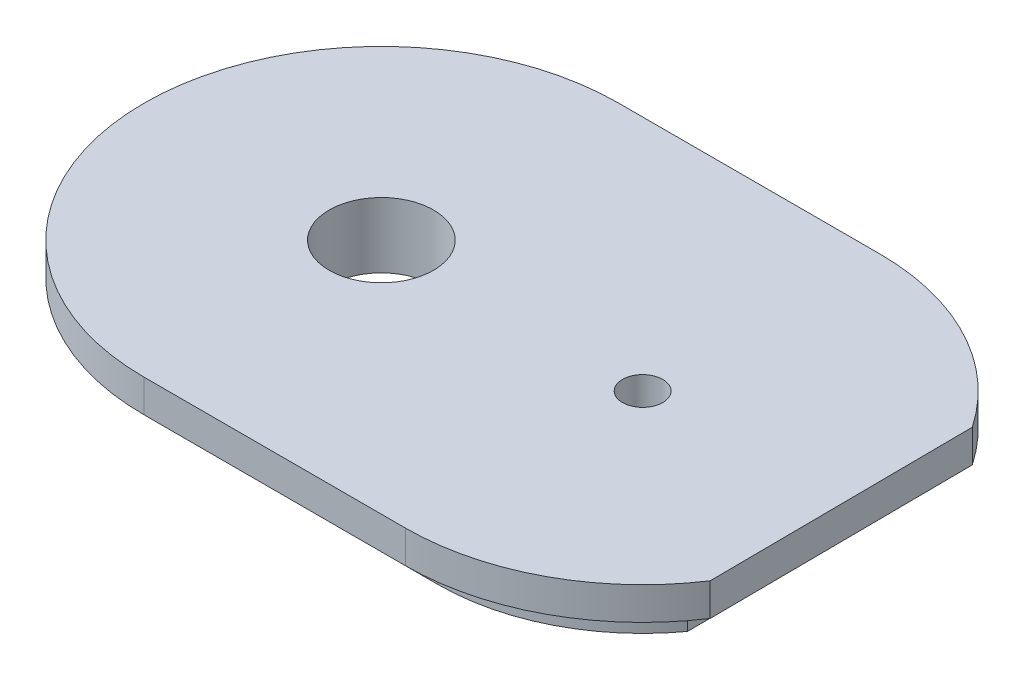
from build123d import *

# Parameters (mm, degrees)
SKETCH1_R           = 0.77
SKETCH1_R_2         = 2
BOSS_EXTRUDE2_DEPTH = 1.25
BOSS_EXTRUDE3_START = 1.25
SKETCH1_5_R         = 0.77
SKETCH1_5_R_2       = 2
BOSS_EXTRUDE3_DEPTH = 1.25


with BuildPart() as part:
    # Sketch1 → Boss-Extrude2 (new body)
    with BuildSketch(Plane(origin=(0, 0, 0), x_dir=(1, 0, 0), z_dir=(0, 1, 0))):
        with BuildLine():
            Line((-14.242139595, -7.835793251), (-4.23908362, -7.835793251))
            ThreePointArc((-4.23908362, -7.835793251), (-0.686146993, -6.984002949), (2.094345322, -4.613819859))
            Line((2.094345322, -4.613819859), (2.026352853, 4.705737102))
            ThreePointArc((2.026352853, 4.705737102), (-0.737193213, 7.009737473), (-4.23908362, 7.835793251))
            Line((-4.23908362, 7.835793251), (-14.242139595, 7.835793251))
            ThreePointArc((-14.242139595, 7.835793251), (-22.077932846, 0), (-14.242139595, -7.835793251))
        make_face()
        with Locations((-4.23908362, 0)):
            Circle(SKETCH1_R, mode=Mode.SUBTRACT)
        with Locations((-14.242139595, 0)):
            Circle(SKETCH1_R_2, mode=Mode.SUBTRACT)
    extrude(amount=-BOSS_EXTRUDE2_DEPTH)

    # Sketch1<5> → Boss-Extrude3 (add)
    with BuildSketch(Plane(origin=(0, 0, 0), x_dir=(1, 0, 0), z_dir=(0, 1, 0)).offset(BOSS_EXTRUDE3_START)):
        with BuildLine():
            Line((3.27343561, 5.110155948), (3.347196034, -5))
            ThreePointArc((3.347196034, -5), (0.069203321, -7.999393891), (-4.23908362, -9.085793251))
            Line((-4.23908362, -9.085793251), (-14.242139595, -9.085793251))
            ThreePointArc((-14.242139595, -9.085793251), (-23.327932846, 0), (-14.242139595, 9.085793251))
            Line((-14.242139595, 9.085793251), (-4.23908362, 9.085793251))
            ThreePointArc((-4.23908362, 9.085793251), (0.010729233, 8.030612038), (3.27343561, 5.110155948))
        make_face()
        with Locations((-4.23908362, 0)):
            Circle(SKETCH1_5_R, mode=Mode.SUBTRACT)
        with Locations((-14.242139595, 0)):
            Circle(SKETCH1_5_R_2, mode=Mode.SUBTRACT)
    extrude(amount=-BOSS_EXTRUDE3_DEPTH)


solid = part.part
